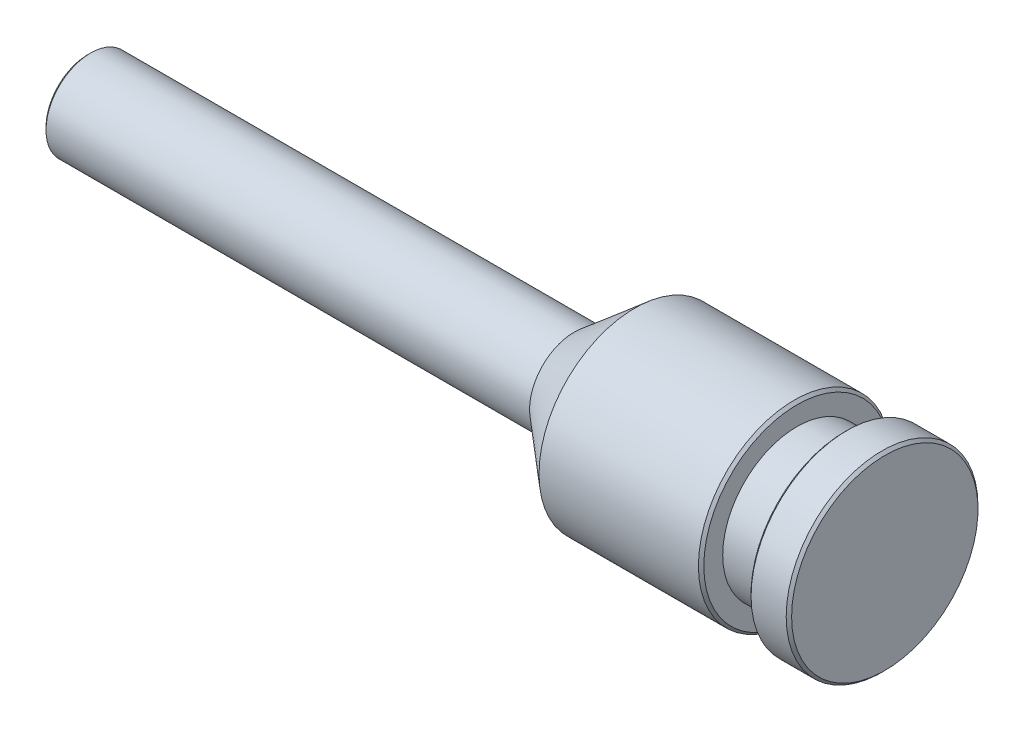
from build123d import *

# Parameters (mm, degrees)
CHANFRO2_SIZE = 0.2


with BuildPart() as part:
    # Esboço1 → Revolução1 (revolve)
    with BuildSketch(Plane.XY, mode=Mode.PRIVATE) as revolu_o1_sk:
        Polygon((13, 0), (59, 0), (59, 7.1), (56, 7.1), (56, 5.5), (52.5, 5.5), (52.5, 7.1), (40.5, 7.1), (36, 3.3), (0, 3.3), (0, 1.85), (13, 1.85), align=None)
    revolve(revolu_o1_sk.sketch.rotate(Axis((13, 0, 0), (1, 0, 0)), 90), axis=Axis((13, 0, 0), (1, 0, 0)))

    # Chanfro2
    chanfro2_edges = [part.edges().sort_by_distance(p)[0] for p in [
        (0, 0, -3.3),
        (52.5, 0, -7.1),
        (56, 0, -7.1),
        (59, 0, -7.1),
    ]]
    chamfer(chanfro2_edges, length=CHANFRO2_SIZE)


solid = part.part
